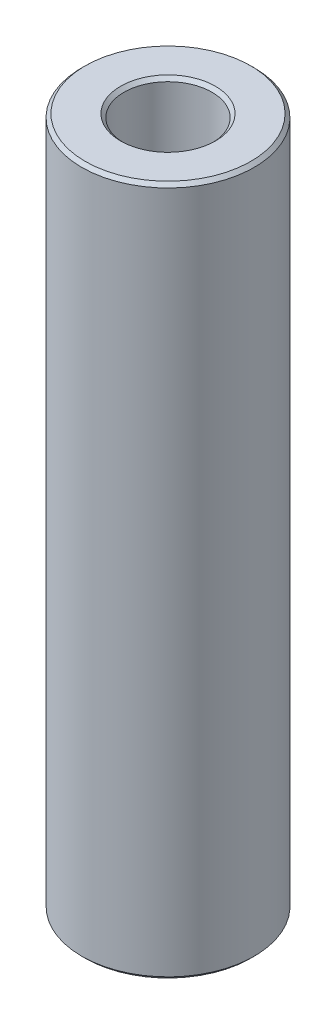
from build123d import *


with BuildPart() as part:
    # Sketch1 → Revolve1 (revolve)
    with BuildSketch(Plane(origin=(0, 0, 0), x_dir=(0, 0, -1), z_dir=(1, 0, 0)), mode=Mode.PRIVATE) as revolve1_sk:
        Polygon((2.55, 19.8), (2.75, 20), (4.8, 20), (5, 19.8), (5, -19.8), (4.8, -20), (2.75, -20), (2.55, -19.8), align=None)
    revolve(revolve1_sk.sketch.rotate(Axis((0, 2.133870968, 0), (0, -1, 0)), 180), axis=Axis((0, 2.133870968, 0), (0, -1, 0)))


solid = part.part
